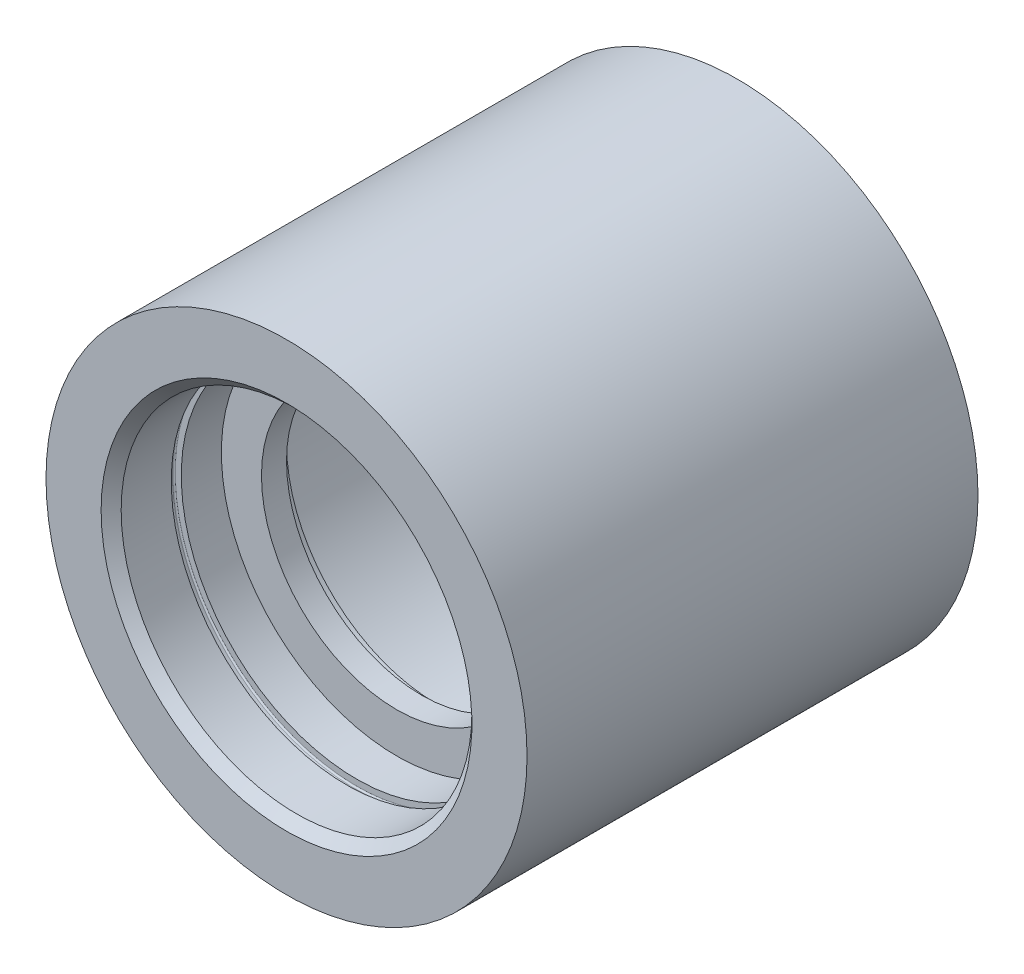
from build123d import *

# Parameters (mm, degrees)
SKETCH_2_R          = 36.5
CUT_EXTRUDE_1_DEPTH = 2
SKETCH_3_R          = 41.75
CUT_EXTRUDE_2_DEPTH = 2.3
FILLET_1_R          = 0.3
CHAMFER_2_SIZE      = 2


with BuildPart() as part:
    # Эскиз1 → Повернуть1 (revolve)
    with BuildSketch(Plane(origin=(0, 0, 0), x_dir=(0, 0, -1), z_dir=(1, 0, 0))):
        Polygon((0, 48), (90, 48), (90, 40), (30, 40), (30, 30), (27, 30), (27, 27), (22, 27), (22, 35), (0, 35), align=None)
    revolve(axis=Axis((0, 0, 0), (0, 0, -1)))

    # Эскиз2 → Вырез-Вытянуть1 (cut)
    with BuildSketch(Plane.XY.offset(-14)):
        Circle(SKETCH_2_R)
    extrude(amount=CUT_EXTRUDE_1_DEPTH, mode=Mode.SUBTRACT)

    # Эскиз3 → Вырез-Вытянуть2 (cut)
    with BuildSketch(Plane(origin=(0, 0, -69), x_dir=(-1, 0, 0), z_dir=(0, 0, -1))):
        Circle(SKETCH_3_R)
    extrude(amount=CUT_EXTRUDE_2_DEPTH, mode=Mode.SUBTRACT)

    # Скругление1
    fillet_1_edges = [part.edges().sort_by_distance(p)[0] for p in [
        (41.75, 0, -71.3),
        (41.75, 0, -69),
        (-36.5, 0, -12),
        (-36.5, 0, -14),
    ]]
    fillet(fillet_1_edges, radius=FILLET_1_R)

    # Фаска2
    chamfer_2_edges = [part.edges().sort_by_distance(p)[0] for p in [
        (0, -35, 0),
        (0, -40, -90),
    ]]
    chamfer(chamfer_2_edges, length=CHAMFER_2_SIZE)


solid = part.part
